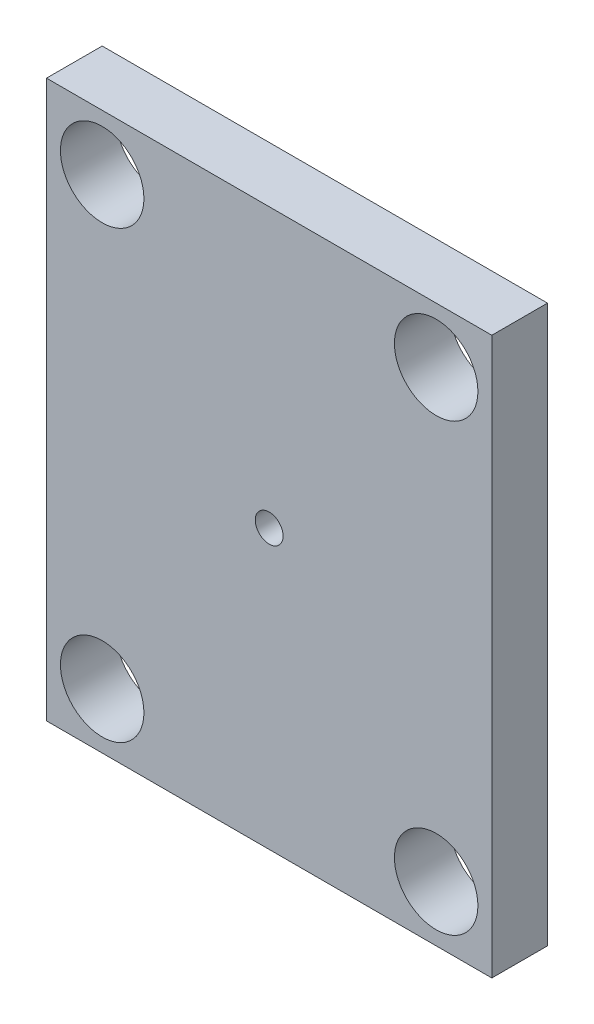
from build123d import *

# Parameters (mm, degrees)
SKETCH1_W           = 101.6
SKETCH1_H           = 127
BOSS_EXTRUDE1_DEPTH = 19.05
SKETCH2_W           = 25.4
SKETCH2_H           = 127
CUT_EXTRUDE1_DEPTH  = 6.35
CUT_EXTRUDE2_REACH  = 165.751
SKETCH4_R           = 6.35
SKETCH9_W           = 50.8
SKETCH9_H           = 50.8
CUT_EXTRUDE7_DEPTH  = 6.35
SKETCH11_R          = 3.175
CUT_EXTRUDE8_DEPTH  = 9.525
SKETCH12_R          = 9.525
CUT_EXTRUDE9_DEPTH  = 164.751221369


with BuildPart() as part:
    # Sketch1 → Boss-Extrude1 (new body)
    with BuildSketch(Plane.XY):
        with Locations((50.8, 63.5)):
            Rectangle(SKETCH1_W, SKETCH1_H)
    extrude(amount=BOSS_EXTRUDE1_DEPTH)

    # Sketch2 → Cut-Extrude1 (cut)
    with BuildSketch(Plane(origin=(0, 0, 0), x_dir=(-1, 0, 0), z_dir=(0, 0, -1))):
        with Locations((-88.9, 63.5)):
            Rectangle(SKETCH2_W, SKETCH2_H)
        with Locations((-12.7, 63.5)):
            Rectangle(SKETCH2_W, SKETCH2_H)
    extrude(amount=-CUT_EXTRUDE1_DEPTH, mode=Mode.SUBTRACT)

    # Sketch4 → Cut-Extrude2 (cut, up to next)
    with BuildSketch(Plane.XY.offset(19.05), mode=Mode.PRIVATE) as cut_extrude2_sk1:
        with Locations((12.7, 114.3)):
            Circle(SKETCH4_R)
    cut_extrude2_tool1 = extrude(cut_extrude2_sk1.sketch, amount=-CUT_EXTRUDE2_REACH, mode=Mode.PRIVATE) & part.part
    # Sketch4 → Cut-Extrude2 (cut, up to next)
    with BuildSketch(Plane.XY.offset(19.05), mode=Mode.PRIVATE) as cut_extrude2_sk2:
        with Locations((12.7, 12.7)):
            Circle(SKETCH4_R)
    cut_extrude2_tool2 = extrude(cut_extrude2_sk2.sketch, amount=-CUT_EXTRUDE2_REACH, mode=Mode.PRIVATE) & part.part
    # Sketch4 → Cut-Extrude2 (cut, up to next)
    with BuildSketch(Plane.XY.offset(19.05), mode=Mode.PRIVATE) as cut_extrude2_sk3:
        with Locations(Location((88.9, 12.7, 0), (0, 0, 180))):
            Circle(SKETCH4_R)
    cut_extrude2_tool3 = extrude(cut_extrude2_sk3.sketch, amount=-CUT_EXTRUDE2_REACH, mode=Mode.PRIVATE) & part.part
    # Sketch4 → Cut-Extrude2 (cut, up to next)
    with BuildSketch(Plane.XY.offset(19.05), mode=Mode.PRIVATE) as cut_extrude2_sk4:
        with Locations(Location((88.9, 114.3, 0), (0, 0, 180))):
            Circle(SKETCH4_R)
    cut_extrude2_tool4 = extrude(cut_extrude2_sk4.sketch, amount=-CUT_EXTRUDE2_REACH, mode=Mode.PRIVATE) & part.part
    add(cut_extrude2_tool1.solids().sort_by_distance((12.7, 114.3, 19.05))[0], mode=Mode.SUBTRACT)
    add(cut_extrude2_tool2.solids().sort_by_distance((12.7, 12.7, 19.05))[0], mode=Mode.SUBTRACT)
    add(cut_extrude2_tool3.solids().sort_by_distance((88.9, 12.7, 19.05))[0], mode=Mode.SUBTRACT)
    add(cut_extrude2_tool4.solids().sort_by_distance((88.9, 114.3, 19.05))[0], mode=Mode.SUBTRACT)

    # Sketch9 → Cut-Extrude7 (cut)
    with BuildSketch(Plane(origin=(0, 0, 0), x_dir=(-1, 0, 0), z_dir=(0, 0, -1))):
        with Locations((-50.8, 25.4)):
            Rectangle(SKETCH9_W, SKETCH9_H)
        with Locations((-50.8, 101.6)):
            Rectangle(SKETCH9_W, SKETCH9_H)
    extrude(amount=-CUT_EXTRUDE7_DEPTH, mode=Mode.SUBTRACT)

    # Sketch11 → Cut-Extrude8 (cut)
    with BuildSketch(Plane.XY.offset(19.05)):
        with Locations((50.8, 63.5)):
            Circle(SKETCH11_R)
    extrude(amount=-CUT_EXTRUDE8_DEPTH, mode=Mode.SUBTRACT)

    # Sketch12 → Cut-Extrude9 (cut, through all)
    with BuildSketch(Plane.XY.offset(19.05)):
        with Locations((12.7, 114.3)):
            Circle(SKETCH12_R)
        with Locations((88.9, 114.3)):
            Circle(SKETCH12_R)
        with Locations((12.7, 12.7)):
            Circle(SKETCH12_R)
        with Locations((88.9, 12.7)):
            Circle(SKETCH12_R)
        with Locations((88.632472784, -89.675466105)):
            Circle(SKETCH12_R)
    extrude(amount=-CUT_EXTRUDE9_DEPTH, mode=Mode.SUBTRACT)


solid = part.part
